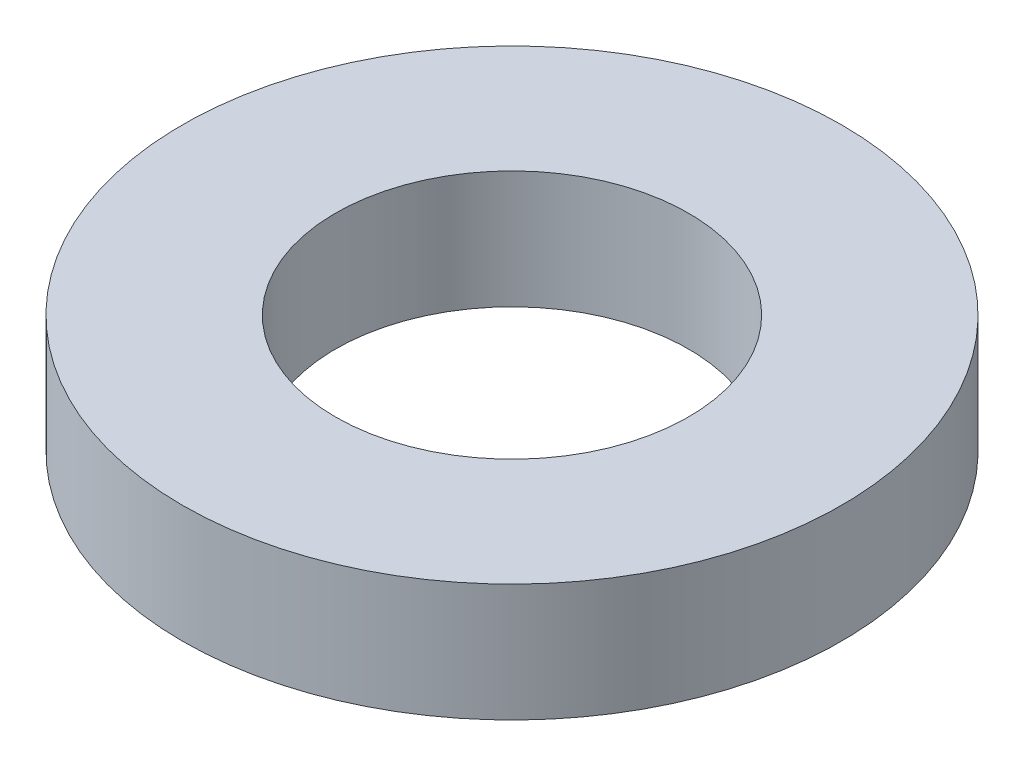
from build123d import *

# Parameters (mm, degrees)
SKETCH1_R           = 2.8
SKETCH1_R_2         = 1.5
BOSS_EXTRUDE1_DEPTH = 1


with BuildPart() as part:
    # Sketch1 → Boss-Extrude1 (new body)
    with BuildSketch(Plane(origin=(0, 0, 0), x_dir=(1, 0, 0), z_dir=(0, 1, 0))):
        with Locations(Location((0, 0, 0), (0, 0, 270))):
            Circle(SKETCH1_R)
        with Locations(Location((0, 0, 0), (0, 0, 270))):
            Circle(SKETCH1_R_2, mode=Mode.SUBTRACT)
    extrude(amount=BOSS_EXTRUDE1_DEPTH)


solid = part.part
